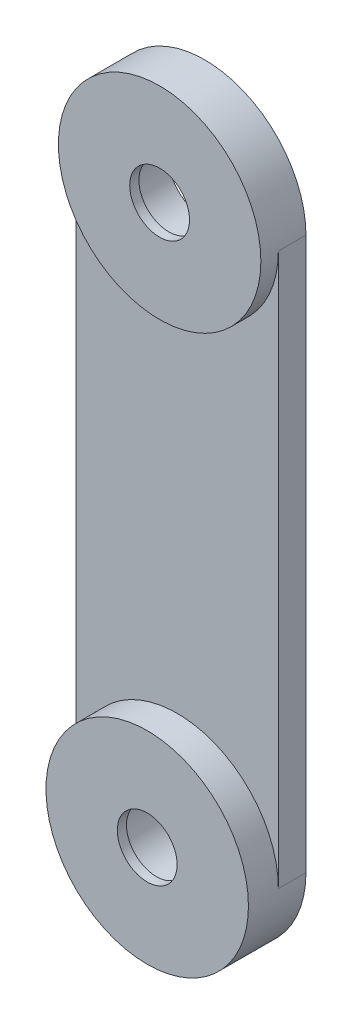
from build123d import *
from build123d.topology import SkipClean

# Parameters (mm, degrees)
ESBO_O1_R                = 11
RESSALTO_EXTRUS_O1_DEPTH = 1.9
RESSALTO_EXTRUS_O3_DEPTH = 3
ESBO_O4_R                = 3.25
CORTE_EXTRUS_O2_DEPTH    = 84.230548987
ESBO_O5_R                = 4
CORTE_EXTRUS_O5_DEPTH    = 3.9
RESSALTO_EXTRUS_O4_START = 3.25
ESBO_O6_R                = 11
RESSALTO_EXTRUS_O4_DEPTH = 3.25
ESBO_O7_R                = 4
CORTE_EXTRUS_O6_DEPTH    = 5.25
ESBO_O8_R                = 3.25
CORTE_EXTRUS_O7_DEPTH    = 84.320926451


with BuildPart() as part:
    # Esboço1 → Ressalto-extrusão1 (new body)
    with BuildSketch(Plane.XY):
        with Locations((13.384187511, -8.427486956)):
            Circle(ESBO_O1_R)
    extrude(amount=-RESSALTO_EXTRUS_O1_DEPTH)

    # Esboço3 → Ressalto-extrusão3 (add)
    with SkipClean():  # the faces are left unmerged after this step: merging them gives an invalid solid
        with BuildSketch(Plane(origin=(0, 0, -1.9), x_dir=(-1, 0, 0), z_dir=(0, 0, -1))):
            with BuildLine():
                Line((-24.384187511, -8.427486956), (-24.384187511, -68.427486956))
                ThreePointArc((-24.384187511, -68.427486956), (-13.384187511, -79.427486956), (-2.384187511, -68.427486956))
                Line((-2.384187511, -68.427486956), (-2.384187511, -8.427486956))
                ThreePointArc((-2.384187511, -8.427486956), (-13.384187511, 2.572513044), (-24.384187511, -8.427486956))
            make_face()
        extrude(amount=RESSALTO_EXTRUS_O3_DEPTH)

    # Esboço4 → Corte-extrusão2 (cut, through all)
    with SkipClean():  # the faces are left unmerged after this step: merging them gives an invalid solid
        with BuildSketch(Plane(origin=(0, 0, -4.9), x_dir=(-1, 0, 0), z_dir=(0, 0, -1))):
            with Locations((-13.384187511, -8.427486956)):
                Circle(ESBO_O4_R)
        extrude(amount=-CORTE_EXTRUS_O2_DEPTH, mode=Mode.SUBTRACT)

    # Esboço5 → Corte-extrusão5 (cut)
    with SkipClean():  # the faces are left unmerged after this step: merging them gives an invalid solid
        with BuildSketch(Plane(origin=(0, 0, -4.9), x_dir=(-1, 0, 0), z_dir=(0, 0, -1))):
            with Locations((-13.384187511, -8.427486956)):
                Circle(ESBO_O5_R)
        extrude(amount=-CORTE_EXTRUS_O5_DEPTH, mode=Mode.SUBTRACT)

    # Esboço6 → Ressalto-extrusão4 (add)
    with SkipClean():  # the faces are left unmerged after this step: merging them gives an invalid solid
        with BuildSketch(Plane.XY.offset(-1.9).offset(RESSALTO_EXTRUS_O4_START)):
            with Locations((13.384187511, -68.427486956)):
                Circle(ESBO_O6_R)
        extrude(amount=-RESSALTO_EXTRUS_O4_DEPTH)

    # Esboço7 → Corte-extrusão6 (cut)
    with SkipClean():  # the faces are left unmerged after this step: merging them gives an invalid solid
        with BuildSketch(Plane(origin=(0, 0, -4.9), x_dir=(-1, 0, 0), z_dir=(0, 0, -1))):
            with Locations((-13.384187511, -68.427486956)):
                Circle(ESBO_O7_R)
        extrude(amount=-CORTE_EXTRUS_O6_DEPTH, mode=Mode.SUBTRACT)

    # Esboço8 → Corte-extrusão7 (cut, through all)
    with SkipClean():  # the faces are left unmerged after this step: merging them gives an invalid solid
        with BuildSketch(Plane(origin=(0, 0, -4.9), x_dir=(-1, 0, 0), z_dir=(0, 0, -1))):
            with Locations((-13.384187511, -68.427486956)):
                Circle(ESBO_O8_R)
        extrude(amount=-CORTE_EXTRUS_O7_DEPTH, mode=Mode.SUBTRACT)


solid = part.part
